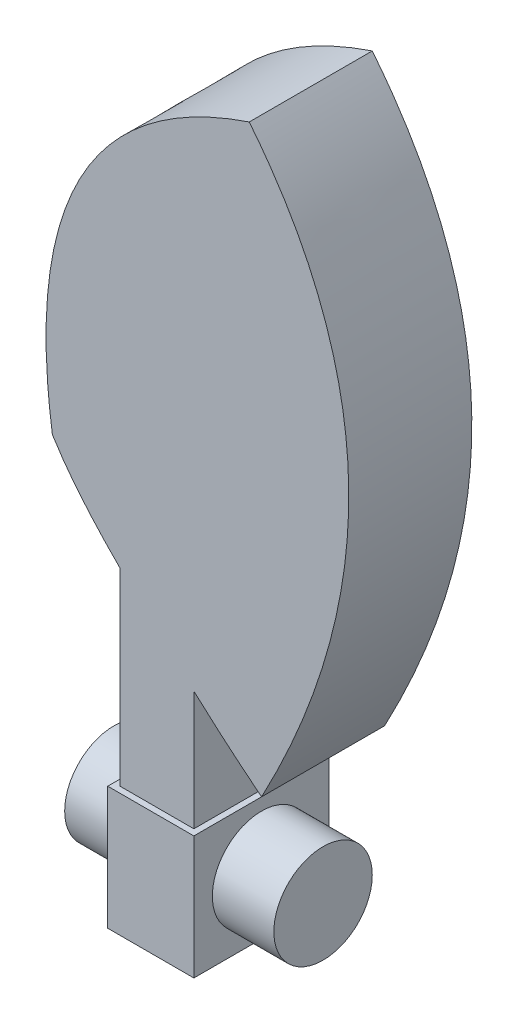
from build123d import *

# Parameters (mm, degrees)
BOSS_EXTRUDE1_DEPTH = 10
BOSS_EXTRUDE3_REACH = 69.263
SKETCH5_W           = 6
SKETCH5_H           = 10
SKETCH6_W           = 6.999999994
SKETCH6_H           = 11
BOSS_EXTRUDE4_DEPTH = 10
SKETCH7_R           = 4
BOSS_EXTRUDE5_DEPTH = 5
BOSS_EXTRUDE6_START = 5
SKETCH8_R           = 4
BOSS_EXTRUDE6_DEPTH = 5


with BuildPart() as part:
    # Sketch1 → Boss-Extrude1 (new body)
    with BuildSketch(Plane.XY):
        with BuildLine():
            add(Edge.make_bspline(
                [(0, 0), (-3.419610413, 23.467889897), (16, 30)],
                knots=[0, 0, 0, 1, 1, 1], degree=2))
            add(Edge.make_bspline(
                [(16, 30), (31.664871657, 10.493306503), (17, -17)],
                knots=[0, 0, 0, 1, 1, 1], degree=2))
            add(Edge.make_bspline(
                [(0, 0), (2.284131215, -3.729797084), (8.779561726, -9.792489567), (13.520650698, -14.223340653), (17, -17)],
                knots=[0, 0, 0, 0, 0.559197284, 1, 1, 1, 1], degree=3))
        make_face()
    extrude(amount=BOSS_EXTRUDE1_DEPTH)

    # Sketch5 → Boss-Extrude3 (add, up to next)
    with BuildSketch(Plane(origin=(0, -32, 0), x_dir=(1, 0, 0), z_dir=(0, 1, 0)), mode=Mode.PRIVATE) as boss_extrude3_sk1:
        with Locations((8.5, -5)):
            Rectangle(SKETCH5_W, SKETCH5_H)
    boss_extrude3_tool1 = extrude(boss_extrude3_sk1.sketch, amount=BOSS_EXTRUDE3_REACH, mode=Mode.PRIVATE) - part.part
    add(boss_extrude3_tool1.solids().sort_by_distance((8.5, -32, 5))[0])

    # Sketch6 → Boss-Extrude4 (add)
    with BuildSketch(Plane(origin=(0, -32, 0), x_dir=(1, 0, 0), z_dir=(0, 1, 0))):
        with Locations((8.499999997, -5)):
            Rectangle(SKETCH6_W, SKETCH6_H)
    extrude(amount=BOSS_EXTRUDE4_DEPTH)

    # Sketch7 → Boss-Extrude5 (add)
    with BuildSketch(Plane(origin=(11.999999994, 0, 0), x_dir=(0, 0, -1), z_dir=(1, 0, 0))):
        with Locations((-5, -27)):
            Circle(SKETCH7_R)
    extrude(amount=BOSS_EXTRUDE5_DEPTH)

    # Sketch8 → Boss-Extrude6 (add)
    with BuildSketch(Plane.ZY.offset(-5).offset(BOSS_EXTRUDE6_START)):
        with Locations(Location((5, -27, 0), (0, 0, 180))):
            Circle(SKETCH8_R)
    extrude(amount=-BOSS_EXTRUDE6_DEPTH)


with BuildPart() as body_2:
    # Split1: the piece on the far side of the plane
    add(part.part)
    split(bisect_by=Plane.ZX.offset(-22), keep=Keep.BOTTOM)


with BuildPart() as part_1:
    add(part.part)

    # Split1
    split(bisect_by=Plane.ZX.offset(-22), keep=Keep.TOP)


solid = Compound([body_2.part, part_1.part])
